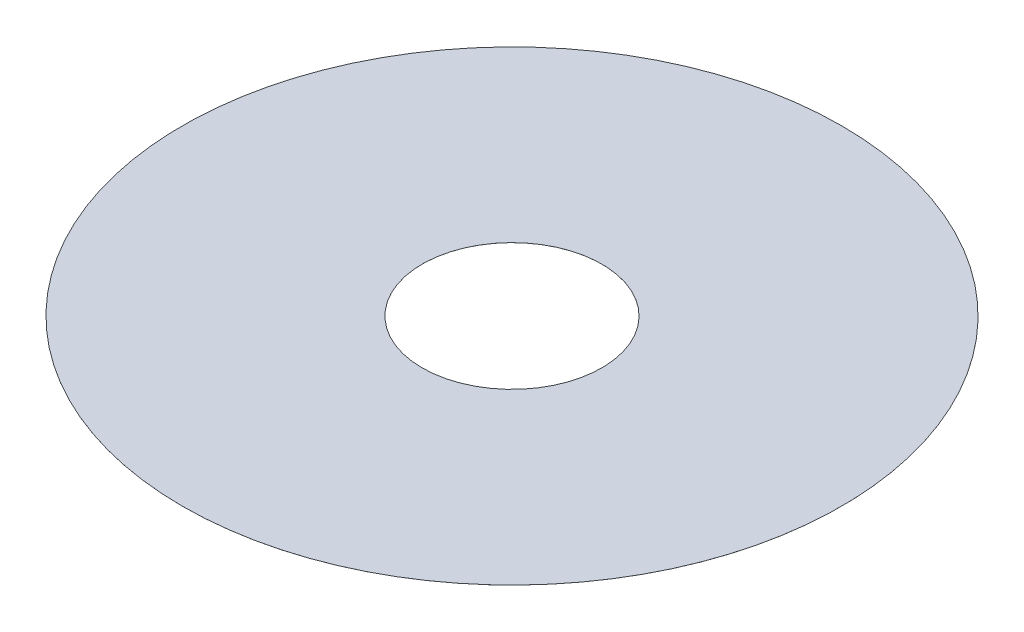
from build123d import *

# Parameters (mm, degrees)
SKETCH1_R           = 22000
SKETCH1_R_2         = 6000
BOSS_EXTRUDE1_DEPTH = 1.5875


with BuildPart() as part:
    # Sketch1 → Boss-Extrude1 (new body)
    with BuildSketch(Plane(origin=(0, 0, 0), x_dir=(1, 0, 0), z_dir=(0, 1, 0))):
        with Locations(Location((0, 0, 0), (0, 0, 270))):
            Circle(SKETCH1_R)
        with Locations(Location((0, 0, 0), (0, 0, 270))):
            Circle(SKETCH1_R_2, mode=Mode.SUBTRACT)
    extrude(amount=BOSS_EXTRUDE1_DEPTH)


solid = part.part
